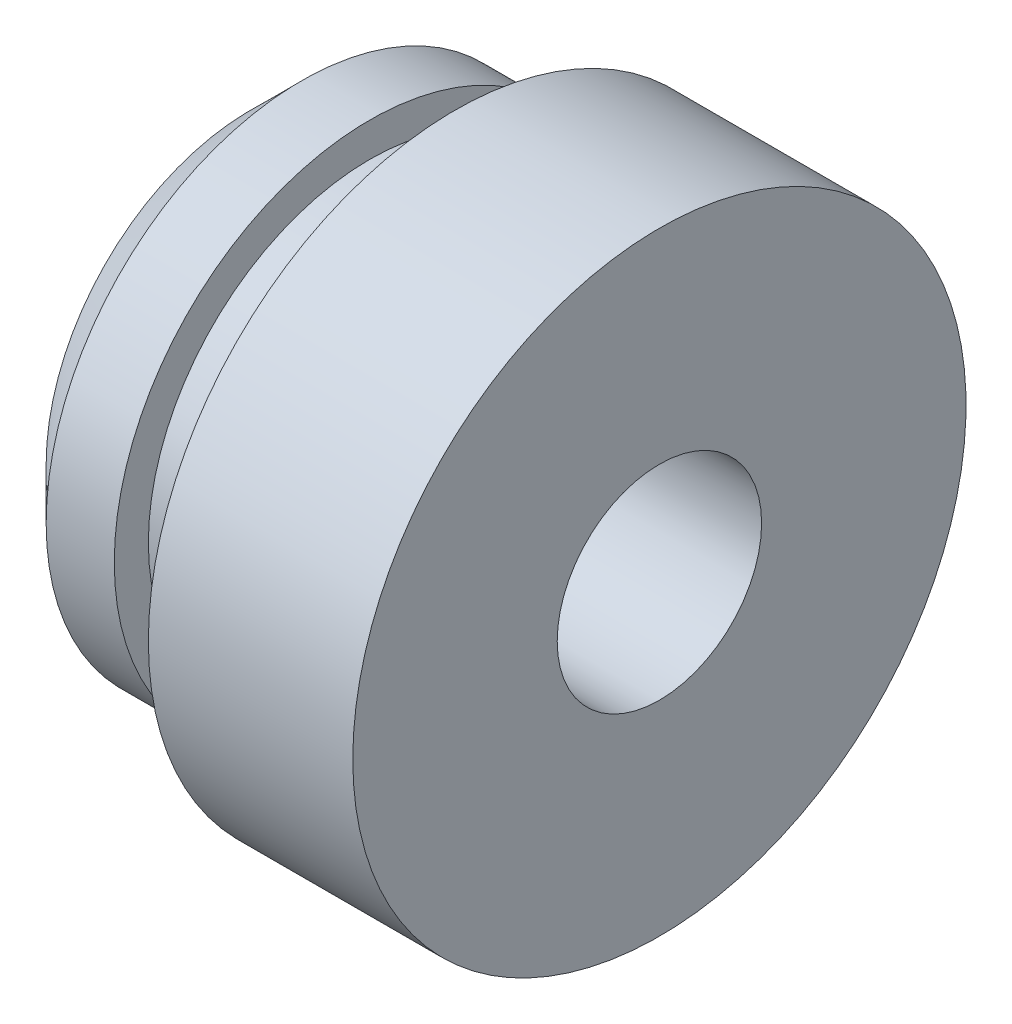
from build123d import *


with BuildPart() as part:
    # 草图1 → 旋转1 (revolve)
    with BuildSketch(Plane.XY, mode=Mode.PRIVATE) as revolve_1_sk:
        Polygon((1295.203733545, 982.830990537), (1295.203733545, 979.830990537), (1290.803733545, 979.830990537), (1290.803733545, 985.830990537), (1292.303733545, 987.330990537), (1294.303733545, 987.330990537), (1294.303733545, 986.330990537), (1296.803733545, 986.330990537), (1296.803733545, 988.830990537), (1302.803733545, 988.830990537), (1302.803733545, 982.830990537), align=None)
    revolve(revolve_1_sk.sketch.rotate(Axis((1287.333765972, 979.830990537, 0), (1, 0, 0)), 90), axis=Axis((1287.333765972, 979.830990537, 0), (1, 0, 0)))


solid = part.part
